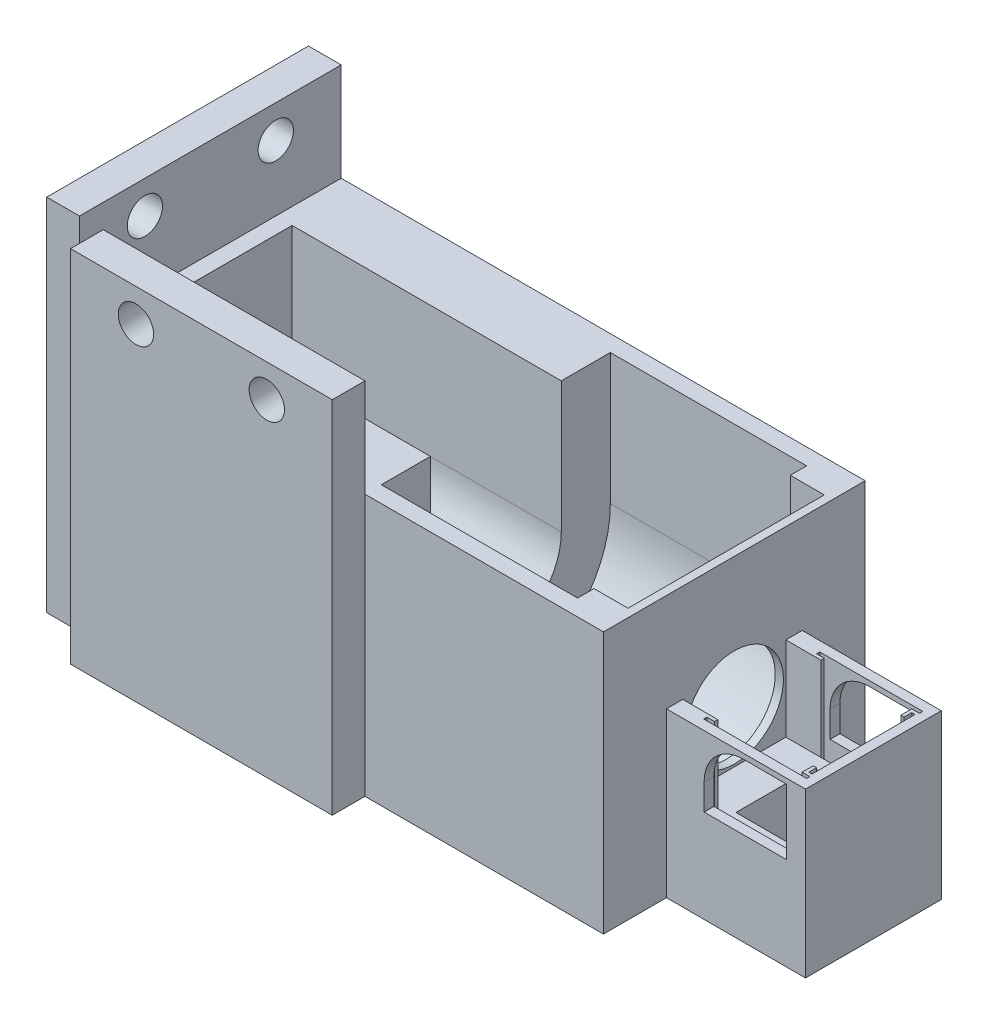
from build123d import *

# Parameters (mm, degrees)
SKETCH1_W                = 116.84
SKETCH1_H                = 50.8
BOSS_EXTRUDE1_DEPTH      = 25.4
SKETCH38_W               = 20
SKETCH38_H               = 20
CUT_EXTRUDE33_DEPTH      = 23.8125
SKETCH37_W               = 50.8
SKETCH37_H               = 25.4
CUT_EXTRUDE32_DEPTH      = 130.912992422
BOSS_EXTRUDE5_DEPTH      = 25.4
CUT_EXTRUDE54_DEPTH      = 96.038097624
CUT_EXTRUDE54_DEPTH_BACK = 96.038097624
SKETCH45_W               = 43.7094
SKETCH45_H               = 19.05
SKETCH53_R               = 2
CUT_EXTRUDE46_DEPTH      = 0.0254
CUT_EXTRUDE55_DEPTH      = 87.36933773
SKETCH61_R               = 9.906
SKETCH61_R_2             = 9.525
BOSS_EXTRUDE11_DEPTH     = 1.5875
BOSS_EXTRUDE17_REACH     = 97.038
SKETCH70_W               = 1.5875
SKETCH70_H               = 19.812
CUT_EXTRUDE56_DEPTH      = 18
SKETCH76_W               = 15
SKETCH76_H               = 15
CUT_EXTRUDE58_DEPTH      = 88.776762301
CUT_EXTRUDE59_DEPTH      = 99.649728332
CUT_EXTRUDE59_DEPTH_BACK = 99.649728332
SKETCH77_W               = 16
SKETCH77_H               = 12.7
BOSS_EXTRUDE18_START     = 25.4
BOSS_EXTRUDE18_DEPTH     = 25.4
SKETCH79_W               = 50.8
SKETCH79_H               = 50.8
BOSS_EXTRUDE19_DEPTH     = 3.175
SKETCH80_W               = 50.8
SKETCH80_H               = 101.6
BOSS_EXTRUDE20_DEPTH     = 6.35
SKETCH81_R               = 3.429
CUT_EXTRUDE60_DEPTH      = 141.668809576
SKETCH82_W               = 50.8
SKETCH82_H               = 101.6
BOSS_EXTRUDE21_DEPTH     = 6.35
SKETCH83_R               = 3.429
CUT_EXTRUDE61_DEPTH      = 133.325529
SKETCH84_W               = 110.249820412
SKETCH84_H               = 109.628139174
CUT_EXTRUDE62_DEPTH      = 31.75
FILLET1_R                = 7.62


with BuildPart() as part:
    # Sketch1 → Boss-Extrude1 (new, symmetric)
    with BuildSketch(Plane.XY):
        with Locations((-17.78, -25.4)):
            Rectangle(SKETCH1_W, SKETCH1_H)
    extrude(amount=BOSS_EXTRUDE1_DEPTH, both=True)

    # Sketch2 → Cut-Revolve1 (revolve, cut)
    with BuildSketch(Plane.XY, mode=Mode.PRIVATE) as cut_revolve1_sk:
        Polygon((-49.3609, -3.175), (-49.3609, -12.7), (-220.202391615, -12.7), (-220.202391615, -25.4), (-157.809194346, -25.4), (-128.417210056, -25.4), (19.629439755, -25.4), (20.7431, -25.4), (20.7431, -15.494), (-4.6569, -15.494), (-4.6569, -6.35), (-11.2609, -6.35), (-11.2609, -3.175), align=None)
    revolve(cut_revolve1_sk.sketch.rotate(Axis((-152.482877195, -25.4, 0), (1, 0, 0)), 90), axis=Axis((-152.482877195, -25.4, 0), (1, 0, 0)), mode=Mode.SUBTRACT)

    # Sketch38 → Cut-Extrude33 (cut)
    with BuildSketch(Plane(origin=(20.7431, 0, 0), x_dir=(0, 0, -1), z_dir=(1, 0, 0))):
        with Locations((0, -25.4)):
            Rectangle(SKETCH38_W, SKETCH38_H)
    extrude(amount=-CUT_EXTRUDE33_DEPTH, mode=Mode.SUBTRACT)

    # Sketch37 → Cut-Extrude32 (cut, through all)
    with BuildSketch(Plane(origin=(40.64, 0, 0), x_dir=(0, 0, -1), z_dir=(1, 0, 0))):
        with Locations((0, -12.7)):
            Rectangle(SKETCH37_W, SKETCH37_H)
    extrude(amount=-CUT_EXTRUDE32_DEPTH, mode=Mode.SUBTRACT)

    # Sketch39 → Boss-Extrude5 (add)
    with BuildSketch(Plane(origin=(0, -25.4, 0), x_dir=(1, 0, 0), z_dir=(0, 1, 0))):
        Polygon((-3.0694, 9.906), (-3.0694, 10), (20.7431, 10), (20.7431, -10), (-3.0694, -10), (-3.0694, -9.906), (-4.6569, -9.906), (-4.6569, -19.05), (-11.2609, -19.05), (-11.2609, -22.225), (-49.3609, -22.225), (-49.3609, -12.7), (-76.2, -12.7), (-76.2, -25.4), (40.64, -25.4), (40.64, 25.4), (-76.2, 25.4), (-76.2, 12.7), (-49.3609, 12.7), (-49.3609, 22.225), (-11.2609, 22.225), (-11.2609, 19.05), (-4.6569, 19.05), (-4.6569, 9.906), align=None)
    extrude(amount=BOSS_EXTRUDE5_DEPTH)

    # Sketch45 → Cut-Extrude54 (cut, two sides: drawn at the far end of the back side and taken through both)
    with BuildSketch(Plane.XY.offset(-CUT_EXTRUDE54_DEPTH_BACK)):
        with Locations((18.7853, -9.525)):
            Rectangle(SKETCH45_W, SKETCH45_H)
    extrude(amount=CUT_EXTRUDE54_DEPTH + CUT_EXTRUDE54_DEPTH_BACK, mode=Mode.SUBTRACT)

    # Sketch53 → Cut-Extrude46 (cut)
    with BuildSketch(Plane.ZY.offset(-20.7431)):
        with Locations((0, -25.4)):
            Circle(SKETCH53_R)
    extrude(amount=-CUT_EXTRUDE46_DEPTH, mode=Mode.SUBTRACT)

    # Sketch72 → Cut-Extrude55 (cut, through all)
    with BuildSketch(Plane(origin=(0, -19.05, 0), x_dir=(1, 0, 0), z_dir=(0, 1, 0))):
        Polygon((-3.0694, -25.4), (-3.0694, -13.175), (23.9181, -13.175), (23.9181, 13.175), (-3.0694, 13.175), (-3.0694, 25.4), (40.64, 25.4), (40.64, -25.4), align=None)
    extrude(amount=-CUT_EXTRUDE55_DEPTH, mode=Mode.SUBTRACT)

    # Sketch61 → Boss-Extrude11 (add)
    with BuildSketch(Plane.ZY.offset(4.6569)):
        with Locations((0, -25.4)):
            Circle(SKETCH61_R)
        with Locations(Location((0, -25.4, 0), (0, 0, 270))):
            Circle(SKETCH61_R_2, mode=Mode.SUBTRACT)
    extrude(amount=-BOSS_EXTRUDE11_DEPTH)

    # Sketch70 → Boss-Extrude17 (add, up to next)
    with BuildSketch(Plane(origin=(0, 0, 0), x_dir=(1, 0, 0), z_dir=(0, 1, 0)), mode=Mode.PRIVATE) as boss_extrude17_sk1:
        with Locations((-3.86315, 0)):
            Rectangle(SKETCH70_W, SKETCH70_H)
    boss_extrude17_tool1 = extrude(boss_extrude17_sk1.sketch, amount=-BOSS_EXTRUDE17_REACH, mode=Mode.PRIVATE) - part.part
    add(boss_extrude17_tool1.solids().sort_by_distance((-3.86315, 0, 0))[0])

    # Sketch73 → Cut-Extrude56 (cut)
    with BuildSketch(Plane(origin=(0, -19.05, 0), x_dir=(1, 0, 0), z_dir=(0, 1, 0))):
        Polygon((20.7431, -8.5), (21.3781, -8.5), (21.3781, -10), (22.0131, -10), (22.0131, 10), (21.3781, 10), (21.3781, 8.5), (20.7431, 8.5), align=None)
        Polygon((2.2431, 11.27), (22.2431, 11.27), (22.2431, 10.635), (20.7431, 10.635), (20.7431, 10), (3.7431, 10), (3.7431, 10.635), (2.2431, 10.635), align=None)
        Polygon((20.7431, -10.635), (22.2431, -10.635), (22.2431, -11.27), (2.2431, -11.27), (2.2431, -10.635), (3.7431, -10.635), (3.7431, -10), (20.7431, -10), align=None)
    extrude(amount=-CUT_EXTRUDE56_DEPTH, mode=Mode.SUBTRACT)

    # Sketch76 → Cut-Extrude58 (cut, through all)
    with BuildSketch(Plane(origin=(0, -35.4, 0), x_dir=(1, 0, 0), z_dir=(0, 1, 0))):
        with Locations((12.2431, 0)):
            Rectangle(SKETCH76_W, SKETCH76_H)
    extrude(amount=-CUT_EXTRUDE58_DEPTH, mode=Mode.SUBTRACT)

    # Sketch77 → Cut-Extrude59 (cut, two sides: drawn at the far end of the back side and taken through both)
    with BuildSketch(Plane.XY.offset(-11.27).offset(-CUT_EXTRUDE59_DEPTH_BACK)):
        with Locations((12.2431, -26.4)):
            Rectangle(SKETCH77_W, SKETCH77_H)
    extrude(amount=CUT_EXTRUDE59_DEPTH + CUT_EXTRUDE59_DEPTH_BACK, mode=Mode.SUBTRACT)

    # Sketch78 → Boss-Extrude18 (add)
    with BuildSketch(Plane.ZY.offset(76.2).offset(BOSS_EXTRUDE18_START)):
        with BuildLine():
            Line((25.4, -50.8), (25.4, 0))
            Line((25.4, 0), (12.7, 0))
            Line((12.7, 0), (12.7, -25.4))
            ThreePointArc((12.7, -25.4), (0, -38.1), (-12.7, -25.4))
            Line((-12.7, -25.4), (-12.7, 0))
            Line((-12.7, 0), (-25.4, 0))
            Line((-25.4, 0), (-25.4, -50.8))
            Line((-25.4, -50.8), (25.4, -50.8))
        make_face()
    extrude(amount=-BOSS_EXTRUDE18_DEPTH)

    # Sketch79 → Boss-Extrude19 (add)
    with BuildSketch(Plane.ZY.offset(101.6)):
        with Locations((0, -25.4)):
            Rectangle(SKETCH79_W, SKETCH79_H)
    extrude(amount=BOSS_EXTRUDE19_DEPTH)

    # Sketch80 → Boss-Extrude20 (add)
    with BuildSketch(Plane.ZY.offset(104.775)):
        Rectangle(SKETCH80_W, SKETCH80_H)
    extrude(amount=BOSS_EXTRUDE20_DEPTH)

    # Sketch81 → Cut-Extrude60 (cut, through all)
    with BuildSketch(Plane(origin=(-104.775, 0, 0), x_dir=(0, 0, -1), z_dir=(1, 0, 0))):
        with Locations((-12.7, 38.1)):
            Circle(SKETCH81_R)
        with Locations((12.7, 38.1)):
            Circle(SKETCH81_R)
        with Locations((12.7, 12.7)):
            Circle(SKETCH81_R)
        with Locations((-12.7, 12.7)):
            Circle(SKETCH81_R)
    extrude(amount=-CUT_EXTRUDE60_DEPTH, mode=Mode.SUBTRACT)

    # Sketch82 → Boss-Extrude21 (add)
    with BuildSketch(Plane.XY.offset(25.4)):
        with Locations((-74.7609, 0)):
            Rectangle(SKETCH82_W, SKETCH82_H)
    extrude(amount=BOSS_EXTRUDE21_DEPTH)

    # Sketch83 → Cut-Extrude61 (cut, through all)
    with BuildSketch(Plane(origin=(0, 0, 25.4), x_dir=(-1, 0, 0), z_dir=(0, 0, -1))):
        with Locations((62.0609, 38.1)):
            Circle(SKETCH83_R)
        with Locations((87.4609, 38.1)):
            Circle(SKETCH83_R)
        with Locations((87.4609, 12.7)):
            Circle(SKETCH83_R)
        with Locations((62.0609, 12.7)):
            Circle(SKETCH83_R)
    extrude(amount=-CUT_EXTRUDE61_DEPTH, mode=Mode.SUBTRACT)

    # Sketch84 → Cut-Extrude62 (cut)
    with BuildSketch(Plane(origin=(0, 50.8, 0), x_dir=(1, 0, 0), z_dir=(0, 1, 0))):
        with Locations((-74.595326767, 1.567462675)):
            Rectangle(SKETCH84_W, SKETCH84_H)
    extrude(amount=-CUT_EXTRUDE62_DEPTH, mode=Mode.SUBTRACT)

    # Fillet1
    fillet1_edges = [part.edges().sort_by_distance(p)[0] for p in [
        (4.2431, -20.05, 12.2225),
        (4.2431, -20.05, -12.2225),
    ]]
    fillet(fillet1_edges, radius=FILLET1_R)


solid = part.part
